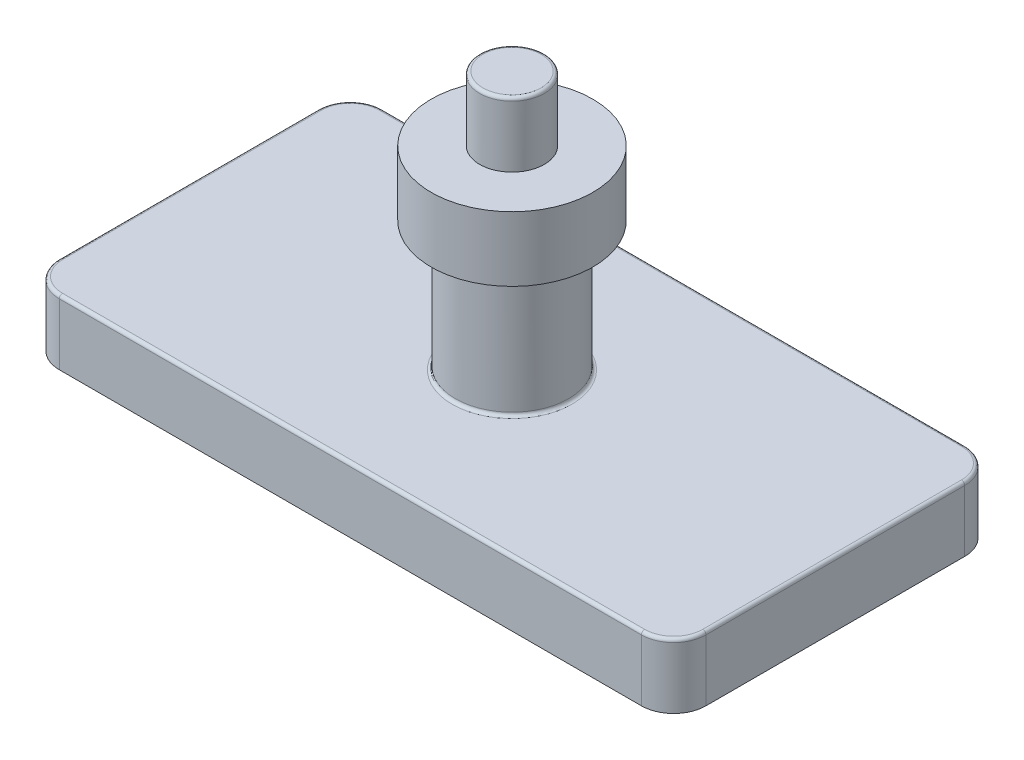
from build123d import *

# Parameters (mm, degrees)
SKETCH1_W      = 254
SKETCH1_H      = 127
EXTRUDE1_DEPTH = 25.4
FILLET1_R      = 12.7
FILLET2_R      = 1.27


with BuildPart() as part:
    # Sketch1 → Extrude1 (new body)
    with BuildSketch(Plane(origin=(0, 0, 0), x_dir=(1, 0, 0), z_dir=(0, 1, 0))):
        Rectangle(SKETCH1_W, SKETCH1_H)
    extrude(amount=EXTRUDE1_DEPTH)

    # Sketch3 → Revolve1 (revolve)
    with BuildSketch(Plane.XY, mode=Mode.PRIVATE) as revolve1_sk:
        Polygon((0, 127), (12.7, 127), (12.7, 101.6), (31.75, 101.6), (31.75, 76.2), (22.225, 76.2), (22.225, 25.4), (0, 25.4), align=None)
    revolve(revolve1_sk.sketch.rotate(Axis((0, 0, 0), (0, 1, 0)), 90), axis=Axis((0, 0, 0), (0, 1, 0)))

    # Fillet1
    fillet1_edges = [part.edges().sort_by_distance(p)[0] for p in [
        (-127, 12.7, -63.5),
        (127, 12.7, -63.5),
        (127, 12.7, 63.5),
        (-127, 12.7, 63.5),
    ]]
    fillet(fillet1_edges, radius=FILLET1_R)

    # Fillet2
    fillet2_edges = [part.edges().sort_by_distance(p)[0] for p in [
        (0, 25.4, 22.225),
        (0, 127, 12.7),
        (127, 25.4, 0),
        (0, 25.4, 63.5),
        (-127, 25.4, 0),
        (0, 25.4, -63.5),
        (-123.280256121, 25.4, 59.780256121),
        (-123.280256121, 25.4, -59.780256121),
        (123.280256121, 25.4, -59.780256121),
        (123.280256121, 25.4, 59.780256121),
    ]]
    fillet(fillet2_edges, radius=FILLET2_R)


solid = part.part
